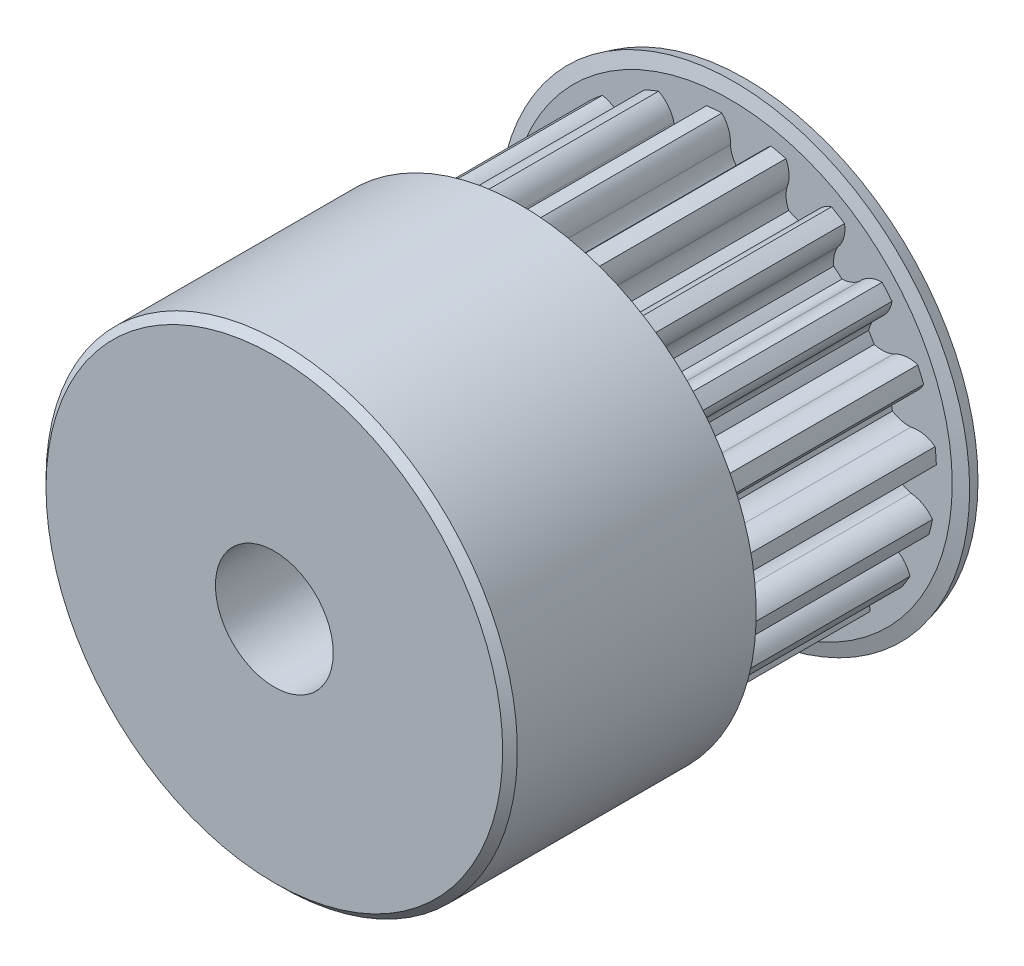
from build123d import *

# Parameters (mm, degrees)
SKETCH1_R           = 7
BOSS_EXTRUDE1_DEPTH = 7
CUT_EXTRUDE1_START  = -7
CUT_EXTRUDE1_DEPTH  = 7
CIRPATTERN1_COUNT   = 20
SKETCH3_R           = 2.5
CUT_EXTRUDE2_DEPTH  = 7
SKETCH8_R           = 3.68210751
SKETCH8_R_2         = 2
BOSS_EXTRUDE2_DEPTH = 8


with BuildPart() as part:
    # Sketch1 → Boss-Extrude1 (new body)
    with BuildSketch(Plane.XY):
        Circle(SKETCH1_R)
    extrude(amount=BOSS_EXTRUDE1_DEPTH)

    # Sketch2 → Cut-Extrude1 (cut)
    with BuildSketch(Plane.XY.offset(7).offset(CUT_EXTRUDE1_START)):
        with BuildLine():
            ThreePointArc((0.972302791, 6.1312752), (1.096934983, 6.541731598), (1.382072919, 6.862206238))
            ThreePointArc((1.382072919, 6.862206238), (0.549882168, 6.978368692), (-0.290231769, 6.993980663))
            ThreePointArc((-0.290231769, 6.993980663), (-0.058806828, 6.632801852), (0, 6.207890809))
            ThreePointArc((0, 6.207890809), (0.07898528, 5.889690377), (0.256638442, 5.614137219))
            ThreePointArc((0.256638442, 5.614137219), (0.441476826, 5.60263315), (0.62583581, 5.585045169))
            ThreePointArc((0.62583581, 5.585045169), (0.844454593, 5.829372853), (0.972302791, 6.1312752))
        make_face()
    cut_extrude1 = extrude(amount=CUT_EXTRUDE1_DEPTH, mode=Mode.SUBTRACT)

    # CirPattern1: Cut-Extrude1 ×20 about axis
    cirpattern1_axis = Axis((0, 0, 0), (0, 0, 1))
    for i in range(1, CIRPATTERN1_COUNT):
        add(cut_extrude1.rotate(cirpattern1_axis, i * 360 / CIRPATTERN1_COUNT), mode=Mode.SUBTRACT)

    # Sketch3 → Cut-Extrude2 (cut)
    with BuildSketch(Plane.XY.offset(7)):
        Circle(SKETCH3_R)
    extrude(amount=-CUT_EXTRUDE2_DEPTH, mode=Mode.SUBTRACT)

    # Sketch4 → Revolve3 (revolve)
    with BuildSketch(Plane(origin=(0, 0, 0), x_dir=(0, 0, -1), z_dir=(1, 0, 0)), mode=Mode.PRIVATE) as revolve3_sk:
        Polygon((0, -7.532770955), (0.125193645, -8), (0.511563976, -7.896472382), (0.4, -7.480109956), (0.4, -2.498650108), (0, -2.498650108), align=None)
    revolve(revolve3_sk.sketch.rotate(Axis((0, 0, 0), (0, 0, -1)), 270), axis=Axis((0, 0, 0), (0, 0, -1)))

    # Sketch7 → Revolve4 (revolve)
    with BuildSketch(Plane(origin=(0, 0, 0), x_dir=(0, 0, -1), z_dir=(1, 0, 0)), mode=Mode.PRIVATE) as revolve4_sk:
        Polygon((-7, 3.370594433), (-7, 7.532770955), (-7.125193645, 8), (-15.235193645, 8), (-15.485193645, 7.75), (-15.485193645, 3.370594433), align=None)
    revolve(revolve4_sk.sketch.rotate(Axis((0, -0.003090187, 7), (0, 0, 1)), 90), axis=Axis((0, -0.003090187, 7), (0, 0, 1)))

    # Sketch8 → Boss-Extrude2 (add)
    with BuildSketch(Plane.XY.offset(15.485193645)):
        Circle(SKETCH8_R)
        Circle(SKETCH8_R_2, mode=Mode.SUBTRACT)
    extrude(amount=-BOSS_EXTRUDE2_DEPTH)


solid = part.part
